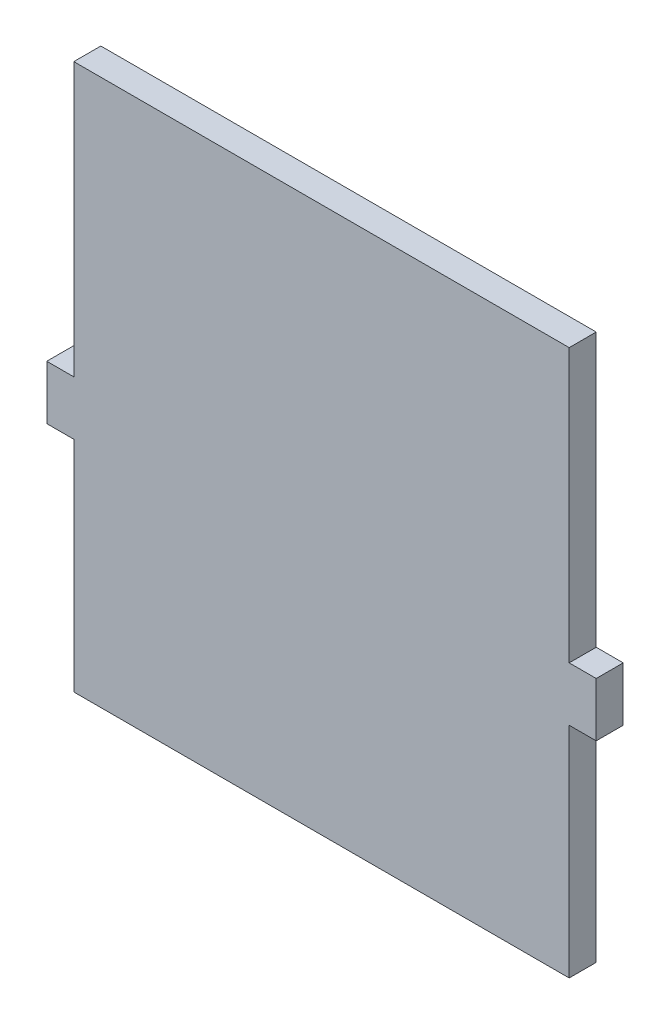
from build123d import *

# Parameters (mm, degrees)
P_IDAT_VYSUNUT_M1_DEPTH = 3


with BuildPart() as part:
    # Skica1 → Přidat vysunutím1 (new body)
    with BuildSketch(Plane.XY):
        Polygon((55, -36.31), (55, -60.61), (0, -60.61), (0, -36.31), (-3, -36.31), (-3, -30.31), (0, -30.31), (0, 0), (55, 0), (55, -30.31), (58, -30.31), (58, -36.31), align=None)
    extrude(amount=P_IDAT_VYSUNUT_M1_DEPTH)


solid = part.part
